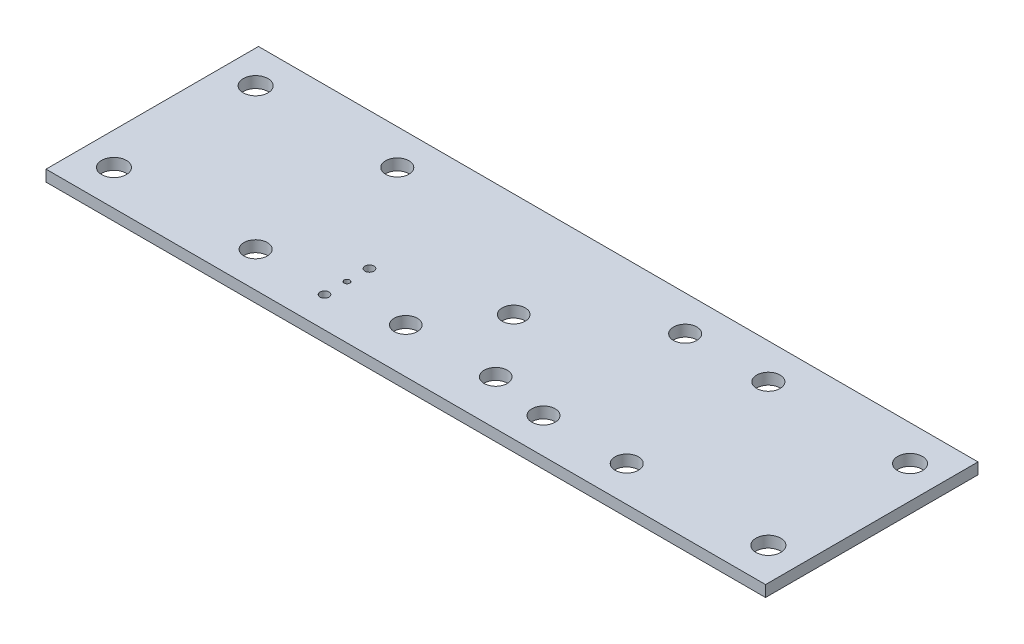
from build123d import *

# Parameters (mm, degrees)
SKETCH1_W                      = 203.2
SKETCH1_H                      = 60
SKETCH1_R                      = 3.3
SKETCH1_R_2                    = 3.5
BOSS_EXTRUDE1_DEPTH            = 3.175
SKETCH2_R                      = 3.2639
F_1_4_20_FOR_NUT_BRACKET_DEPTH = 106.984152707
SKETCH3_R                      = 0.79375
SKETCH3_R_2                    = 1.27
WIRE_HOLDER_DEPTH              = 106.984152707
SKETCH4_R                      = 3.3
CUT_EXTRUDE1_DEPTH             = 106.984152707


with BuildPart() as part:
    # Sketch1 → Boss-Extrude1 (new body)
    with BuildSketch(Plane(origin=(0, 0, 0), x_dir=(1, 0, 0), z_dir=(0, 1, 0))):
        Rectangle(SKETCH1_W, SKETCH1_H)
        with Locations(Location((-52.4, 20, 0), (0, 0, 270))):
            Circle(SKETCH1_R, mode=Mode.SUBTRACT)
        with Locations(Location((-92.4, -20, 0), (0, 0, 90))):
            Circle(SKETCH1_R_2, mode=Mode.SUBTRACT)
        with Locations(Location((-52.4, -20, 0), (0, 0, 90))):
            Circle(SKETCH1_R, mode=Mode.SUBTRACT)
        with Locations(Location((92.4, 20, 0), (0, 0, 90))):
            Circle(SKETCH1_R_2, mode=Mode.SUBTRACT)
        with Locations(Location((-92.4, 20, 0), (0, 0, 270))):
            Circle(SKETCH1_R_2, mode=Mode.SUBTRACT)
        with Locations(Location((52.4, -20, 0), (0, 0, 270))):
            Circle(SKETCH1_R, mode=Mode.SUBTRACT)
        with Locations(Location((92.4, -20, 0), (0, 0, 270))):
            Circle(SKETCH1_R_2, mode=Mode.SUBTRACT)
        with Locations(Location((52.4, 20, 0), (0, 0, 90))):
            Circle(SKETCH1_R, mode=Mode.SUBTRACT)
    extrude(amount=BOSS_EXTRUDE1_DEPTH)

    # Sketch2 → 1/4-20 for Nut Bracket (cut, through all)
    with BuildSketch(Plane(origin=(0, 3.175, 0), x_dir=(1, 0, 0), z_dir=(0, 1, 0))):
        with Locations(Location((-12.7, -17.3, 0), (0, 0, 270))):
            Circle(SKETCH2_R)
        with Locations(Location((12.7, -17.3, 0), (0, 0, 270))):
            Circle(SKETCH2_R)
        with Locations(Location((0, 0.48, 0), (0, 0, 270))):
            Circle(SKETCH2_R)
    extrude(amount=-F_1_4_20_FOR_NUT_BRACKET_DEPTH, mode=Mode.SUBTRACT)

    # Sketch3 → Wire Holder (cut, through all)
    with BuildSketch(Plane(origin=(0, 3.175, 0), x_dir=(1, 0, 0), z_dir=(0, 1, 0))):
        with Locations(Location((-31.6, -15, 0), (0, 0, 270))):
            Circle(SKETCH3_R)
        with Locations(Location((-31.6, -8.65, 0), (0, 0, 270))):
            Circle(SKETCH3_R_2)
        with Locations(Location((-31.6, -21.35, 0), (0, 0, 270))):
            Circle(SKETCH3_R_2)
    extrude(amount=-WIRE_HOLDER_DEPTH, mode=Mode.SUBTRACT)

    # Sketch4 → Cut-Extrude1 (cut, through all)
    with BuildSketch(Plane(origin=(0, 3.175, 0), x_dir=(1, 0, 0), z_dir=(0, 1, 0))):
        with Locations(Location((28.9, -20, 0), (0, 0, 270))):
            Circle(SKETCH4_R)
        with Locations(Location((28.9, 20, 0), (0, 0, 270))):
            Circle(SKETCH4_R)
    extrude(amount=-CUT_EXTRUDE1_DEPTH, mode=Mode.SUBTRACT)


solid = part.part
